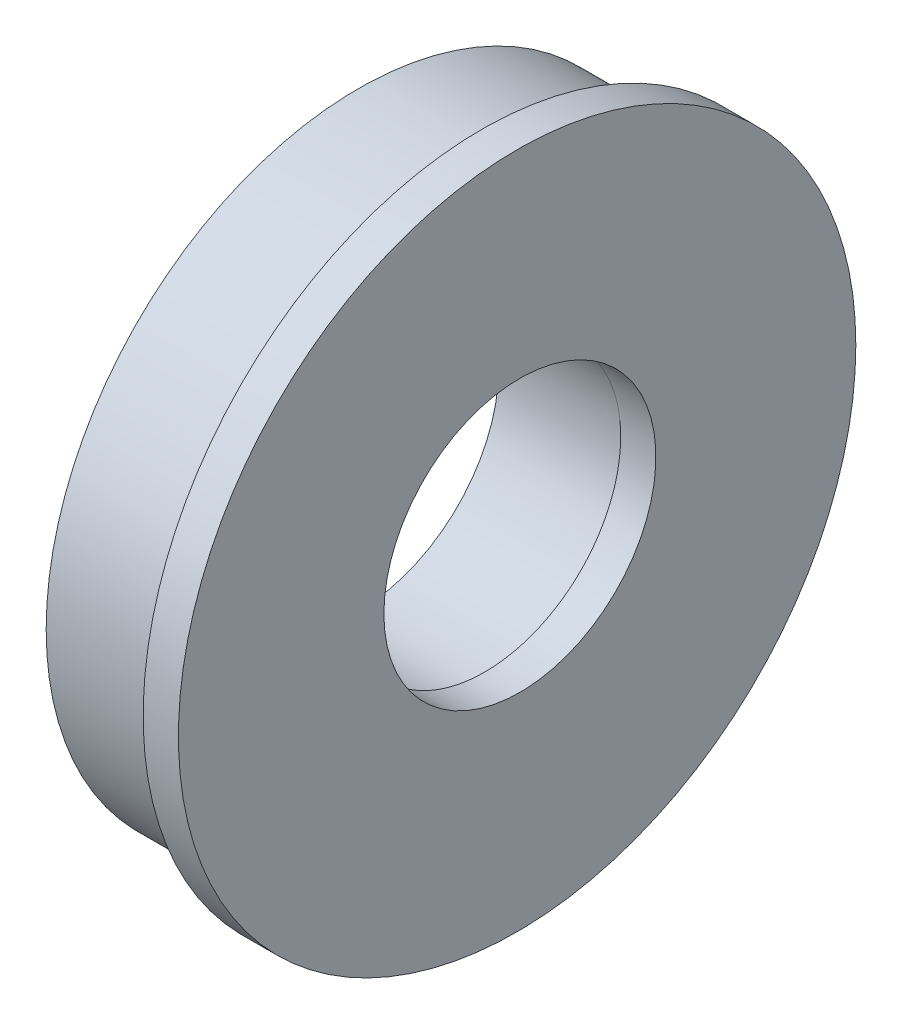
from build123d import *

# Parameters (mm, degrees)
SKETCH2_R           = 35.421020706
SKETCH2_R_2         = 15.915175003
BOSS_EXTRUDE1_DEPTH = 14
SKETCH3_R           = 38.421020706
BOSS_EXTRUDE2_DEPTH = 4
SKETCH4_R           = 15.428921843
CUT_EXTRUDE1_DEPTH  = 4


with BuildPart() as part:
    # Sketch2 → Boss-Extrude1 (new body)
    with BuildSketch(Plane(origin=(0, 0, 0), x_dir=(0, 0, -1), z_dir=(1, 0, 0))):
        with Locations((-373.314059341, 282.690366741)):
            Circle(SKETCH2_R)
        with Locations((-373.314059341, 282.690366741)):
            Circle(SKETCH2_R_2, mode=Mode.SUBTRACT)
    extrude(amount=BOSS_EXTRUDE1_DEPTH)

    # Sketch3 → Boss-Extrude2 (add)
    with BuildSketch(Plane(origin=(14, 0, 0), x_dir=(0, 0, -1), z_dir=(1, 0, 0))):
        with Locations((-373.314059341, 282.690366741)):
            Circle(SKETCH3_R)
    extrude(amount=BOSS_EXTRUDE2_DEPTH)

    # Sketch4 → Cut-Extrude1 (cut)
    with BuildSketch(Plane.ZY.offset(-14)):
        with Locations((372.999807552, 283.061430009)):
            Circle(SKETCH4_R)
    extrude(amount=-CUT_EXTRUDE1_DEPTH, mode=Mode.SUBTRACT)


solid = part.part
